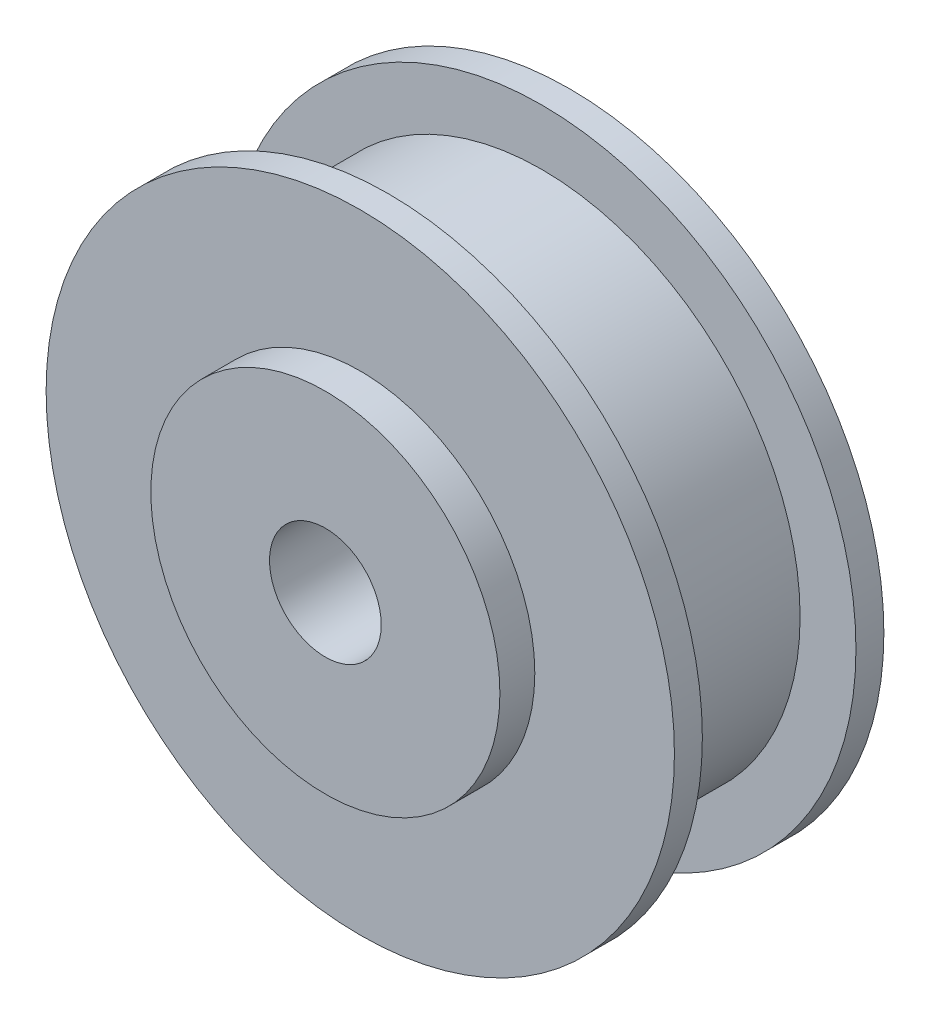
from build123d import *

# Parameters (mm, degrees)
SKETCH_1_R          = 22.5
EXTRUDE_1_DEPTH     = 15
SKETCH_2_R          = 12.5
EXTRUDE_2_DEPTH     = 2.5
SKETCH_3_R          = 4
CUT_EXTRUDE_1_DEPTH = 45
SKETCH_5_W          = 4
SKETCH_5_H          = 11


with BuildPart() as part:
    # 草图1 → 凸台-拉伸1 (new body)
    with BuildSketch(Plane.XY):
        Circle(SKETCH_1_R)
    extrude(amount=EXTRUDE_1_DEPTH)

    # 草图2 → 凸台-拉伸2 (add)
    with BuildSketch(Plane.XY.offset(15)):
        Circle(SKETCH_2_R)
    extrude(amount=EXTRUDE_2_DEPTH)

    # 草图3 → 切除-拉伸1 (cut)
    with BuildSketch(Plane.XY.offset(17.5)):
        Circle(SKETCH_3_R)
    extrude(amount=-CUT_EXTRUDE_1_DEPTH, mode=Mode.SUBTRACT)

    # 草图5 → 切除-旋转1 (revolve, cut)
    with BuildSketch(Plane(origin=(0, 0, 0), x_dir=(1, 0, 0), z_dir=(0, 1, 0)), mode=Mode.PRIVATE) as cut_revolve_1_sk:
        with Locations((20.5, -7.5)):
            Rectangle(SKETCH_5_W, SKETCH_5_H)
    revolve(cut_revolve_1_sk.sketch.rotate(Axis((0, 0, 0), (0, 0, 1)), 180), axis=Axis((0, 0, 0), (0, 0, 1)), mode=Mode.SUBTRACT)


solid = part.part
